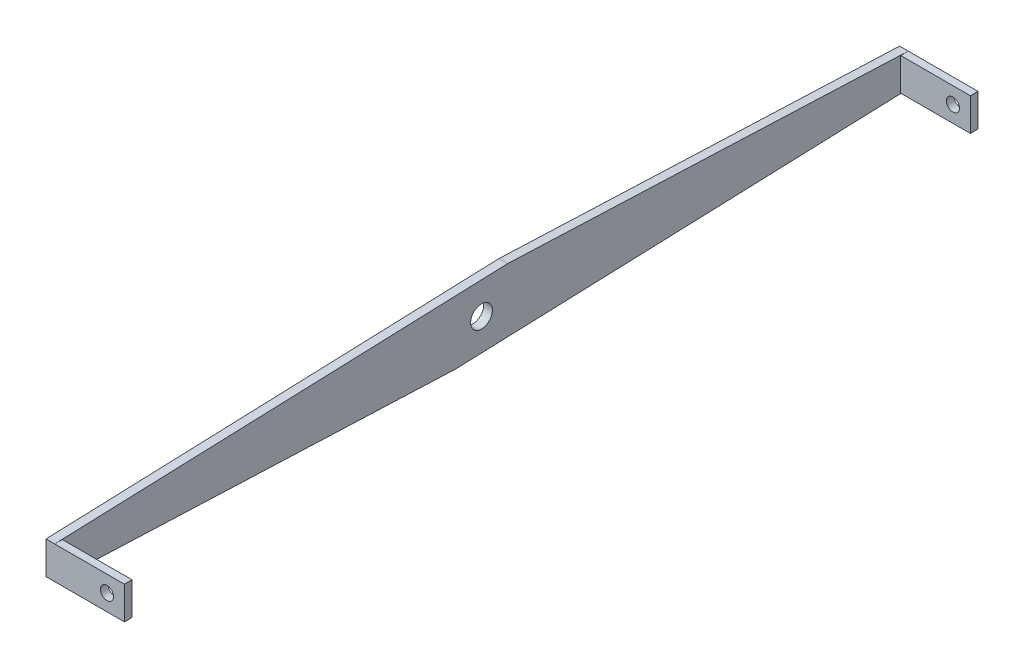
from build123d import *

# Parameters (mm, degrees)
BOSS_EXTRUDE2_DEPTH = 2
SKETCH4_W           = 3.5
SKETCH4_H           = 15
BOSS_EXTRUDE3_DEPTH = 32
SKETCH5_R           = 3
CUT_EXTRUDE1_DEPTH  = 392
SKETCH7_R           = 5
CUT_EXTRUDE2_DEPTH  = 5


with BuildPart() as part:
    # Sketch2 → Boss-Extrude2 (new, symmetric)
    with BuildSketch(Plane(origin=(0, 0, 0), x_dir=(0, 0, -1), z_dir=(1, 0, 0))):
        Polygon((0, 0), (208, 7.5), (392, 0), (392, -15), (184, -22.5), (0, -15), align=None)
    extrude(amount=BOSS_EXTRUDE2_DEPTH, both=True)

    # Sketch4 → Boss-Extrude3 (add)
    with BuildSketch(Plane(origin=(2, 0, 0), x_dir=(0, 0, -1), z_dir=(1, 0, 0))):
        with Locations((1.75, -7.5)):
            Rectangle(SKETCH4_W, SKETCH4_H)
        with Locations((390.25, -7.5)):
            Rectangle(SKETCH4_W, SKETCH4_H)
    extrude(amount=BOSS_EXTRUDE3_DEPTH)

    # Sketch5 → Cut-Extrude1 (cut)
    with BuildSketch(Plane.XY):
        with Locations((26, -7.5)):
            Circle(SKETCH5_R)
    extrude(amount=-CUT_EXTRUDE1_DEPTH, mode=Mode.SUBTRACT)

    # Sketch7 → Cut-Extrude2 (cut)
    with BuildSketch(Plane.ZY.offset(2)):
        with Locations((-196, -7.5)):
            Circle(SKETCH7_R)
    extrude(amount=-CUT_EXTRUDE2_DEPTH, mode=Mode.SUBTRACT)


solid = part.part
